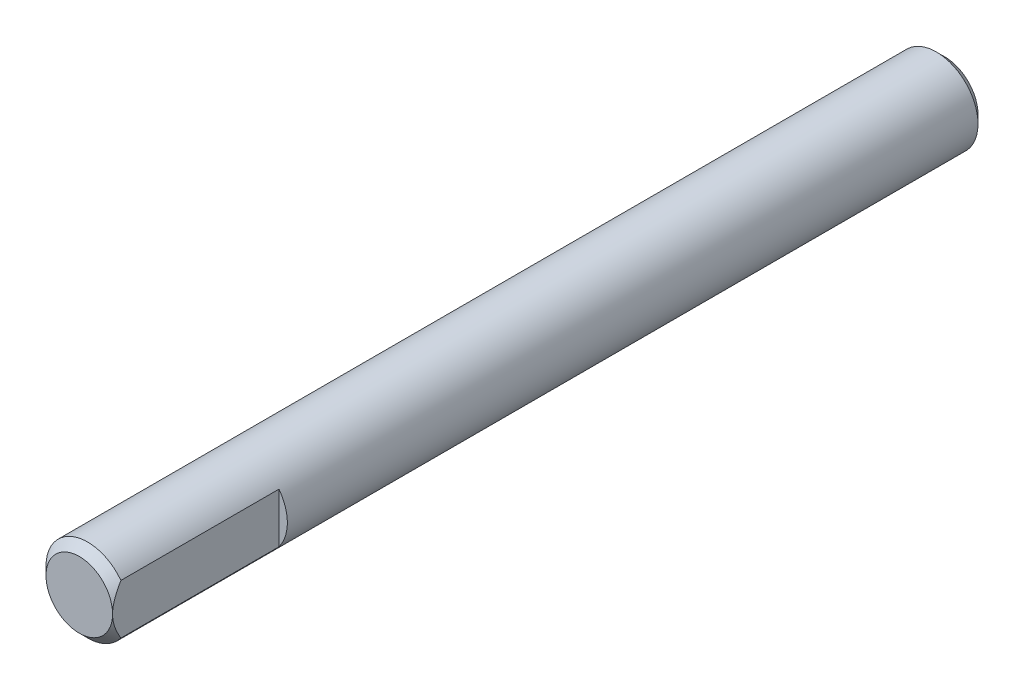
from build123d import *

# Parameters (mm, degrees)
SKETCH1_R           = 2.5
BOSS_EXTRUDE1_DEPTH = 52
CHAMFER1_SIZE       = 0.5
CUT_EXTRUDE1_DEPTH  = 10


with BuildPart() as part:
    # Sketch1 → Boss-Extrude1 (new body)
    with BuildSketch(Plane.XY):
        with Locations(Location((0, 0, 0), (0, 0, 180))):
            Circle(SKETCH1_R)
    extrude(amount=BOSS_EXTRUDE1_DEPTH)

    # Chamfer1
    chamfer1_edges = [part.edges().sort_by_distance(p)[0] for p in [
        (2.5, 0, 0),
        (2.5, 0, 52),
    ]]
    chamfer(chamfer1_edges, length=CHAMFER1_SIZE)

    # Sketch2 → Cut-Extrude1 (cut)
    with BuildSketch(Plane.XY.offset(52)):
        Polygon((2, 2.063355138), (2, -2.020256336), (3.167761935, -2.440469654), (4.48227539, -2.12800334), align=None)
    extrude(amount=-CUT_EXTRUDE1_DEPTH, mode=Mode.SUBTRACT)


solid = part.part
